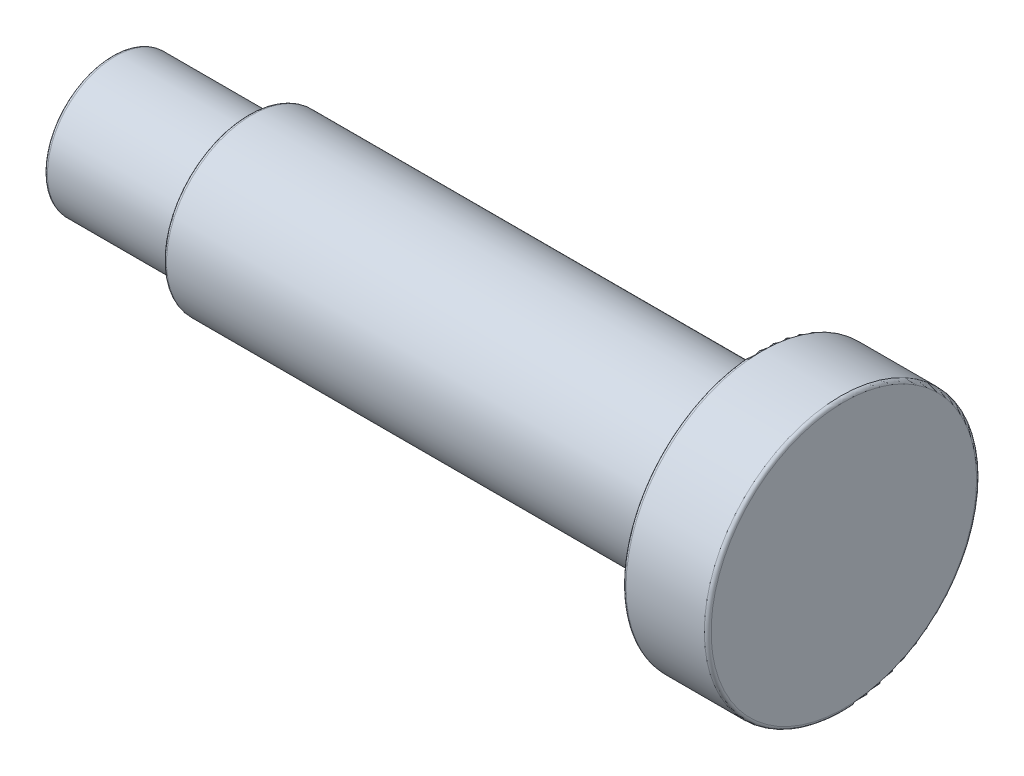
from build123d import *

# Parameters (mm, degrees)
SKETCH2_R           = 63.5
BOSS_EXTRUDE1_DEPTH = 190.5
SKETCH3_R           = 50.8
BOSS_EXTRUDE2_DEPTH = 101.6
SKETCH4_R           = 101.6
BOSS_EXTRUDE3_DEPTH = 63.5
FILLET1_R           = 2.54
FILLET2_R           = 2.54


with BuildPart() as part:
    # Sketch2 → Boss-Extrude1 (new, symmetric)
    with BuildSketch(Plane(origin=(0, 0, 0), x_dir=(0, 0, -1), z_dir=(1, 0, 0))):
        Circle(SKETCH2_R)
    extrude(amount=BOSS_EXTRUDE1_DEPTH, both=True)

    # Sketch3 → Boss-Extrude2 (add)
    with BuildSketch(Plane.ZY.offset(190.5)):
        Circle(SKETCH3_R)
    extrude(amount=BOSS_EXTRUDE2_DEPTH)

    # Sketch4 → Boss-Extrude3 (add)
    with BuildSketch(Plane(origin=(190.5, 0, 0), x_dir=(0, 0, -1), z_dir=(1, 0, 0))):
        Circle(SKETCH4_R)
    extrude(amount=BOSS_EXTRUDE3_DEPTH)

    # Fillet1
    fillet1_edges = [part.edges().sort_by_distance(p)[0] for p in [
        (254, 0, 101.6),
        (190.5, 0, 101.6),
    ]]
    fillet(fillet1_edges, radius=FILLET1_R)

    # Fillet2
    fillet2_edges = [part.edges().sort_by_distance(p)[0] for p in [
        (-190.5, 0, 63.5),
        (-292.1, 0, -50.8),
    ]]
    fillet(fillet2_edges, radius=FILLET2_R)


solid = part.part
